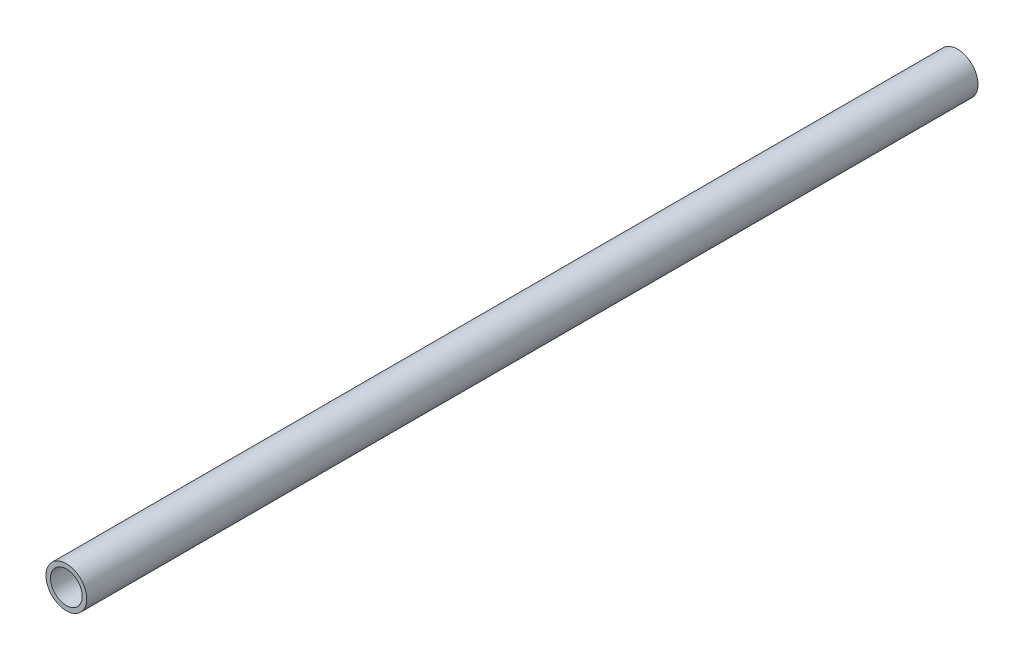
from build123d import *

# Parameters (mm, degrees)
SKETCH1_R           = 9
SKETCH1_R_2         = 7
BOSS_EXTRUDE1_DEPTH = 393.26


with BuildPart() as part:
    # Sketch1 → Boss-Extrude1 (new body)
    with BuildSketch(Plane.XY):
        Circle(SKETCH1_R)
        Circle(SKETCH1_R_2, mode=Mode.SUBTRACT)
    extrude(amount=BOSS_EXTRUDE1_DEPTH)


solid = part.part
